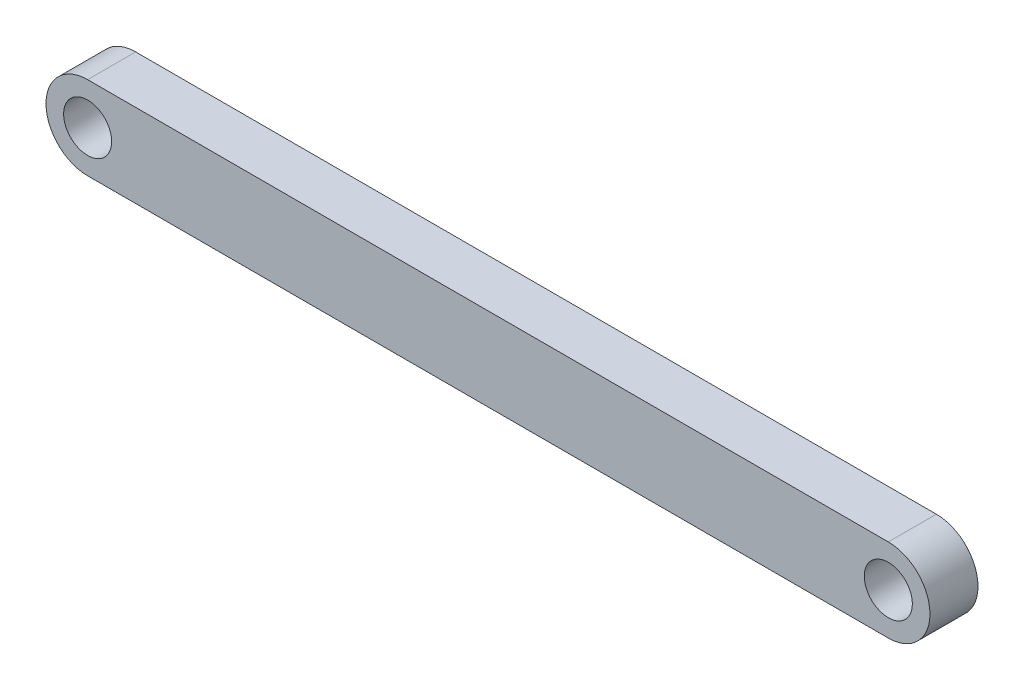
from build123d import *

# Parameters (mm, degrees)
SKETCH1_R           = 7.5
BOSS_EXTRUDE1_DEPTH = 15


with BuildPart() as part:
    # Sketch1 → Boss-Extrude1 (new body)
    with BuildSketch(Plane.XY):
        with BuildLine():
            Line((-125, 13), (125, 13))
            ThreePointArc((125, 13), (138, 0), (125, -13))
            Line((125, -13), (-125, -13))
            ThreePointArc((-125, -13), (-138, 0), (-125, 13))
        make_face()
        with Locations((-125, 0)):
            Circle(SKETCH1_R, mode=Mode.SUBTRACT)
        with Locations((125, 0)):
            Circle(SKETCH1_R, mode=Mode.SUBTRACT)
    extrude(amount=-BOSS_EXTRUDE1_DEPTH)


solid = part.part
